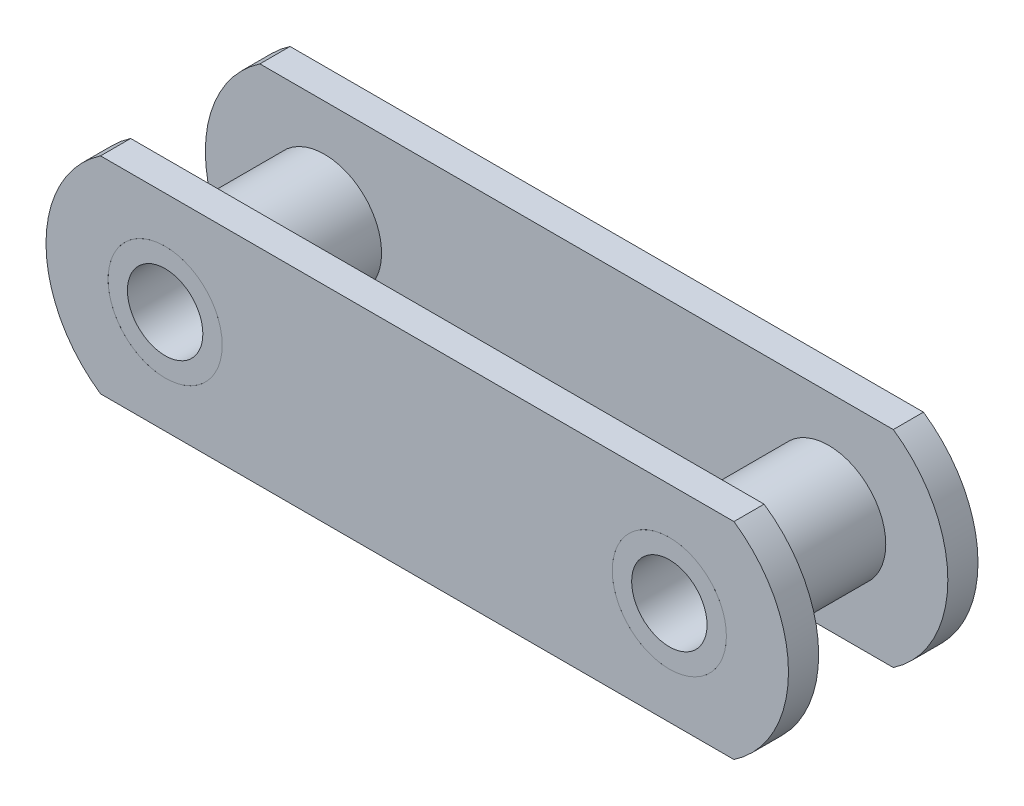
from build123d import *

# Parameters (mm, degrees)
BOSS_EXTRUDE1_START     = 18.85
BOSS_EXTRUDE1_DEPTH     = 6
SKETCH2_R               = 7.5
CUT_EXTRUDE2_DEPTH      = 79.926516457
CUT_EXTRUDE3_DEPTH      = 79.926516457
CUT_EXTRUDE3_DEPTH_BACK = 79.926516457
SKETCH3_R               = 11.35
BOSS_EXTRUDE2_START     = -18.85
SKETCH4_R               = 11.35
SKETCH4_R_2             = 7.5
BOSS_EXTRUDE2_DEPTH     = 37.7


with BuildPart() as part:
    # Sketch1 → Boss-Extrude1 (new body)
    with BuildSketch(Plane.XY.offset(BOSS_EXTRUDE1_START)):
        with BuildLine():
            Line((-63, 20.5), (63, 20.5))
            ThreePointArc((63, 20.5), (73.85, 0), (63, -20.5))
            Line((63, -20.5), (-63, -20.5))
            ThreePointArc((-63, -20.5), (-73.85, 0), (-63, 20.5))
        make_face()
    extrude(amount=-BOSS_EXTRUDE1_DEPTH)

    # Sketch2 → Cut-Extrude2 (cut, through all)
    with BuildSketch(Plane.XY):
        with Locations((-50.15, 0)):
            Circle(SKETCH2_R)
        with Locations(Location((50.15, 0, 0), (0, 0, 180))):
            Circle(SKETCH2_R)
    extrude(amount=CUT_EXTRUDE2_DEPTH, mode=Mode.SUBTRACT)


with BuildPart() as body_2:
    # Mirror1: mirrored copy
    add(part.part.mirror(Plane.XY))


with BuildPart() as cut_extrude3_tool:
    # Sketch3 → Cut-Extrude3 (new, two sides: drawn at the far end of the back side and taken through both)
    with BuildSketch(Plane.XY.offset(-CUT_EXTRUDE3_DEPTH_BACK)):
        with Locations((-50.15, 0)):
            Circle(SKETCH3_R)
        with Locations((50.15, 0)):
            Circle(SKETCH3_R)
    extrude(amount=CUT_EXTRUDE3_DEPTH + CUT_EXTRUDE3_DEPTH_BACK)


with BuildPart() as part_1:
    add(part.part)

    # Cut-Extrude3: cut by cut_extrude3_tool
    add(cut_extrude3_tool.part, mode=Mode.SUBTRACT)


with BuildPart() as body_2_1:
    add(body_2.part)

    # Cut-Extrude3: cut by cut_extrude3_tool
    add(cut_extrude3_tool.part, mode=Mode.SUBTRACT)


with BuildPart() as body_3:
    # Sketch4 → Boss-Extrude2 (new body)
    with BuildSketch(Plane.XY.offset(BOSS_EXTRUDE2_START)):
        with Locations(Location((-50.15, 0, 0), (0, 0, 180))):
            Circle(SKETCH4_R)
        with Locations(Location((-50.15, 0, 0), (0, 0, 180))):
            Circle(SKETCH4_R_2, mode=Mode.SUBTRACT)
    extrude(amount=BOSS_EXTRUDE2_DEPTH)


with BuildPart() as body_4:
    # Mirror2: mirrored copy
    add(body_3.part.mirror(Plane(origin=(0, 0, 0), x_dir=(0, 0, 1), z_dir=(1, 0, 0))))


solid = Compound([part_1.part, body_2_1.part, body_3.part, body_4.part])
